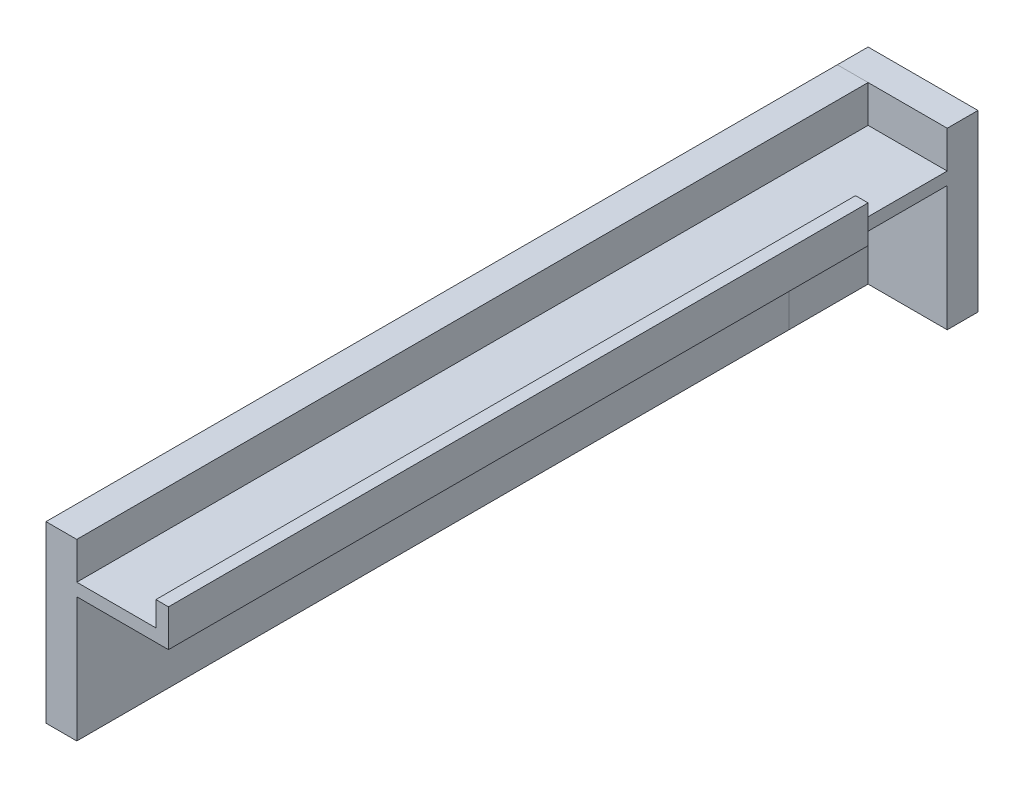
from build123d import *

# Parameters (mm, degrees)
BOSS_EXTRUDE1_DEPTH = 288.036
SKETCH2_W           = 5.08
SKETCH2_H           = 5.08
CUT_EXTRUDE1_DEPTH  = 299.722207266
SKETCH3_W           = 12.446
SKETCH3_H           = 70.614516874
SKETCH3_W_2         = 31.996
SKETCH3_H_2         = 5.08
BOSS_EXTRUDE2_DEPTH = 32
SKETCH7_W           = 44.446
SKETCH7_H           = 70.61
BOSS_EXTRUDE3_DEPTH = 12.45


with BuildPart() as part:
    # Sketch1 → Boss-Extrude1 (new body)
    with BuildSketch(Plane.XY):
        Polygon((-44.446, 17.892402527), (-44.446, -52.722114347), (-31.996, -52.722114347), (-31.996, -2.187597473), (5.08, -2.187597473), (5.08, 12.812402527), (0, 12.812402527), (0, 2.892402527), (-32, 2.892402527), (-32, 17.892402527), align=None)
    extrude(amount=BOSS_EXTRUDE1_DEPTH)

    # Sketch2 → Cut-Extrude1 (cut, through all)
    with BuildSketch(Plane(origin=(0, 12.812402527, 0), x_dir=(1, 0, 0), z_dir=(0, 1, 0))):
        with Locations((2.54, -2.54)):
            Rectangle(SKETCH2_W, SKETCH2_H)
    extrude(amount=-CUT_EXTRUDE1_DEPTH, mode=Mode.SUBTRACT)

    # Sketch3 → Boss-Extrude2 (add)
    with BuildSketch(Plane(origin=(0, 0, 0), x_dir=(-1, 0, 0), z_dir=(0, 0, -1))):
        with Locations((38.223, -17.41485591)):
            Rectangle(SKETCH3_W, SKETCH3_H)
        with Locations((15.998, 0.352402527)):
            Rectangle(SKETCH3_W_2, SKETCH3_H_2)
    extrude(amount=BOSS_EXTRUDE2_DEPTH)

    # Sketch7 → Boss-Extrude3 (add)
    with BuildSketch(Plane(origin=(0, 0, -32), x_dir=(-1, 0, 0), z_dir=(0, 0, -1))):
        with Locations((22.223, -17.417114347)):
            Rectangle(SKETCH7_W, SKETCH7_H)
    extrude(amount=BOSS_EXTRUDE3_DEPTH)


solid = part.part
